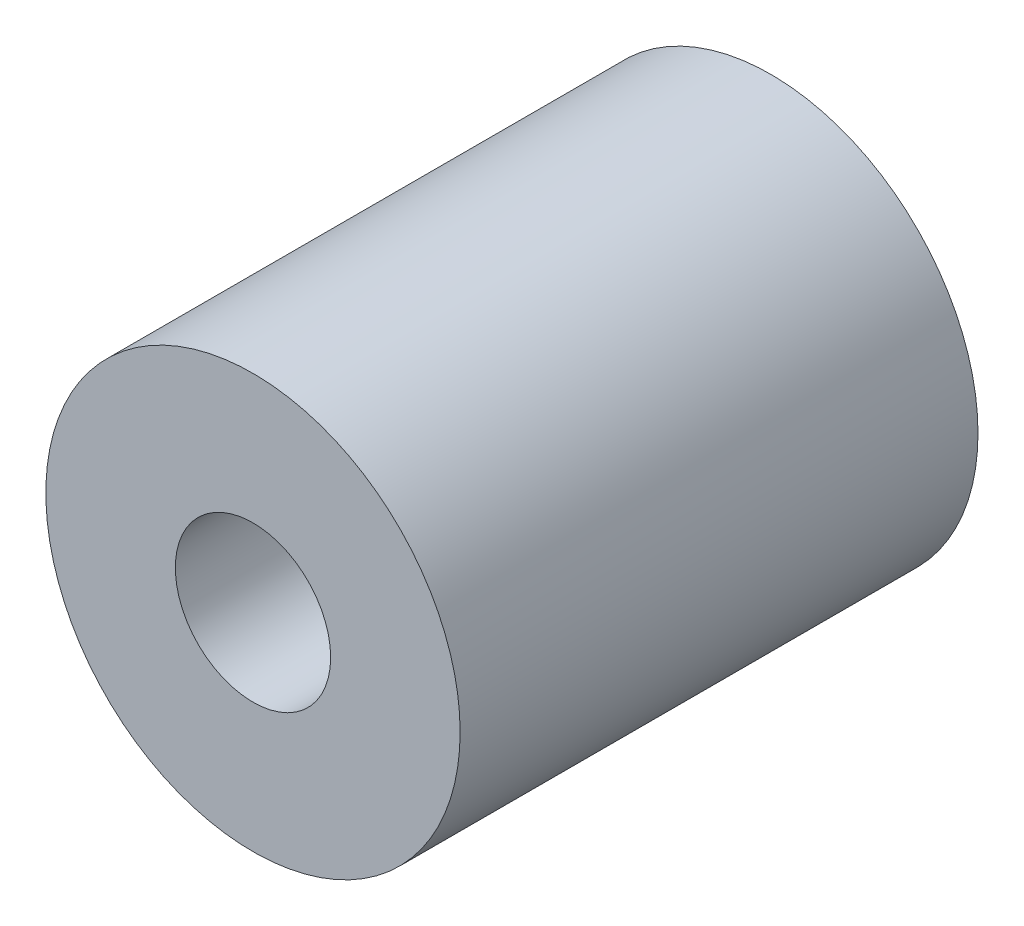
from build123d import *

# Parameters (mm, degrees)
AUFSATZ_LINEAR_AUSTRAGEN1_DEPTH      = 10
AUFSATZ_LINEAR_AUSTRAGEN1_DEPTH_BACK = 10
SKIZZE1_R                            = 8
F_6_0_6_DURCHMESSER_BOHRUNG1_D       = 6
F_6_0_6_DURCHMESSER_BOHRUNG1_DEPTH   = 8.197418143
F_6_0_6_DURCHMESSER_BOHRUNG1_TIP     = 1.802581857
F_5_0_5_DURCHMESSER_BOHRUNG5_D       = 5
F_5_0_5_DURCHMESSER_BOHRUNG5_DEPTH   = 18.497848452
F_5_0_5_DURCHMESSER_BOHRUNG5_TIP     = 1.502151548


with BuildPart() as part:
    # Skizze1 → Aufsatz-Linear austragen1 (new, two sides: drawn at the far end of the back side and taken through both)
    with BuildSketch(Plane.XY.offset(-AUFSATZ_LINEAR_AUSTRAGEN1_DEPTH_BACK)):
        Circle(SKIZZE1_R)
    extrude(amount=AUFSATZ_LINEAR_AUSTRAGEN1_DEPTH + AUFSATZ_LINEAR_AUSTRAGEN1_DEPTH_BACK)

    # Ø6.0 (6) Durchmesser Bohrung1
    with Locations(Plane.XY.offset(10)):
        with Locations((0, 0)):
            Hole(F_6_0_6_DURCHMESSER_BOHRUNG1_D / 2, depth=F_6_0_6_DURCHMESSER_BOHRUNG1_DEPTH)
            with Locations((0, 0, -(F_6_0_6_DURCHMESSER_BOHRUNG1_DEPTH + F_6_0_6_DURCHMESSER_BOHRUNG1_TIP / 2))):  # 118° drill point
                Cone(0, F_6_0_6_DURCHMESSER_BOHRUNG1_D / 2, F_6_0_6_DURCHMESSER_BOHRUNG1_TIP, mode=Mode.SUBTRACT)

    # Ø5.0 (5) Durchmesser Bohrung5
    with Locations(Plane(origin=(0, 0, -10), x_dir=(-1, 0, 0), z_dir=(0, 0, -1))):
        with Locations((0, 0)):
            Hole(F_5_0_5_DURCHMESSER_BOHRUNG5_D / 2, depth=F_5_0_5_DURCHMESSER_BOHRUNG5_DEPTH)
            with Locations((0, 0, -(F_5_0_5_DURCHMESSER_BOHRUNG5_DEPTH + F_5_0_5_DURCHMESSER_BOHRUNG5_TIP / 2))):  # 118° drill point
                Cone(0, F_5_0_5_DURCHMESSER_BOHRUNG5_D / 2, F_5_0_5_DURCHMESSER_BOHRUNG5_TIP, mode=Mode.SUBTRACT)


solid = part.part
